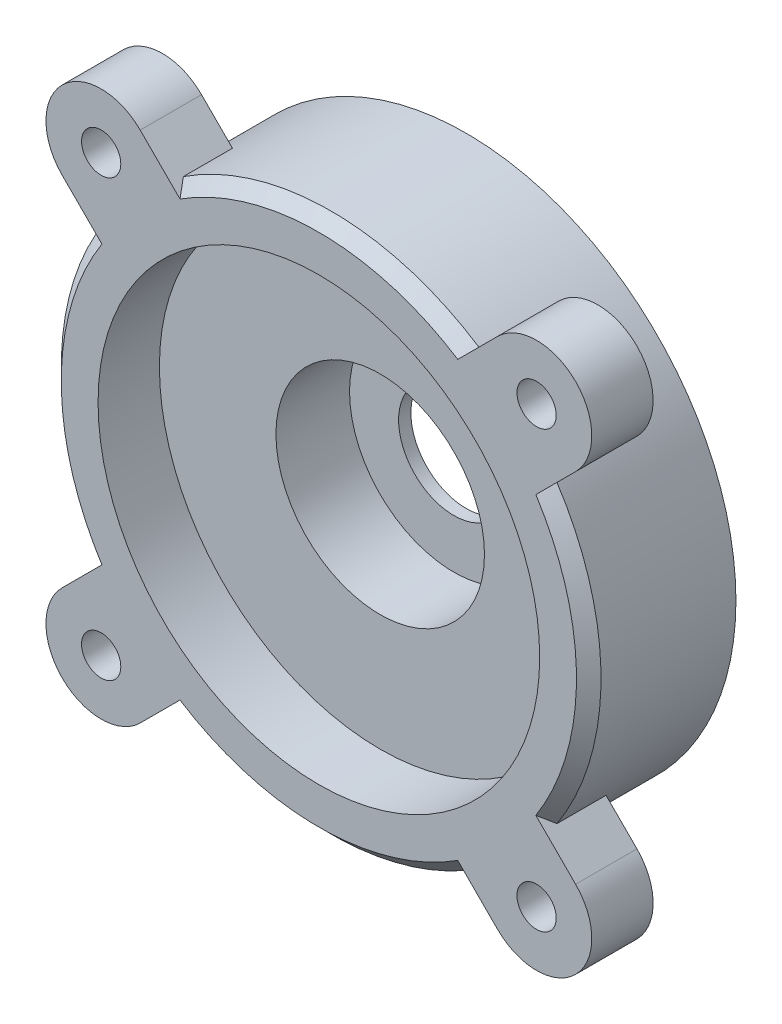
from build123d import *

# Parameters (mm, degrees)
SKETCH1_R           = 22
BOSS_EXTRUDE1_DEPTH = 6
CHAMFER1_SIZE       = 1
SKETCH8_R           = 1.6
BOSS_EXTRUDE2_DEPTH = 5
SKETCH9_R           = 18
CUT_EXTRUDE1_DEPTH  = 5
SKETCH10_R          = 8.5
CUT_EXTRUDE2_DEPTH  = 6
SKETCH11_R          = 4.5
CUT_EXTRUDE3_DEPTH  = 1


with BuildPart() as part:
    # Sketch1 → Boss-Extrude1 (new, symmetric)
    with BuildSketch(Plane.XY):
        Circle(SKETCH1_R)
    extrude(amount=BOSS_EXTRUDE1_DEPTH, both=True)

    # Chamfer1
    chamfer1_edges = [part.edges().sort_by_distance(p)[0] for p in [
        (-22, 0, 6),
    ]]
    chamfer(chamfer1_edges, length=CHAMFER1_SIZE)

    # Sketch8 → Boss-Extrude2 (add)
    # profile 1 of 4: a face of its own
    with BuildSketch(Plane.XY.offset(6)):
        with BuildLine():
            Line((20.930360723, -14.566399692), (17.68629022, -11.322329189))
            Line((17.68629022, -11.322329189), (11.322329189, -17.68629022))
            Line((11.322329189, -17.68629022), (14.566399692, -20.930360723))
            ThreePointArc((14.566399692, -20.930360723), (20.930360723, -20.930360723), (20.930360723, -14.566399692))
        make_face()
        with Locations((17.748380208, -17.748380208)):
            Circle(SKETCH8_R, mode=Mode.SUBTRACT)
    # profile 2 of 4: a face of its own
    with BuildSketch(Plane.XY.offset(6)):
        with BuildLine():
            Line((14.566399692, 20.930360723), (11.322329189, 17.68629022))
            Line((11.322329189, 17.68629022), (17.68629022, 11.322329189))
            Line((17.68629022, 11.322329189), (20.930360723, 14.566399692))
            ThreePointArc((20.930360723, 14.566399692), (20.930360723, 20.930360723), (14.566399692, 20.930360723))
        make_face()
        with Locations((17.748380208, 17.748380208)):
            Circle(SKETCH8_R, mode=Mode.SUBTRACT)
    # profile 3 of 4: a face of its own
    with BuildSketch(Plane.XY.offset(6)):
        with BuildLine():
            Line((-14.566399692, -20.930360723), (-11.322329189, -17.68629022))
            Line((-11.322329189, -17.68629022), (-17.68629022, -11.322329189))
            Line((-17.68629022, -11.322329189), (-20.930360723, -14.566399692))
            ThreePointArc((-20.930360723, -14.566399692), (-20.930360723, -20.930360723), (-14.566399692, -20.930360723))
        make_face()
        with Locations((-17.748380208, -17.748380208)):
            Circle(SKETCH8_R, mode=Mode.SUBTRACT)
    # profile 4 of 4: a face of its own
    with BuildSketch(Plane.XY.offset(6)):
        with BuildLine():
            Line((-20.930360723, 14.566399692), (-17.68629022, 11.322329189))
            Line((-17.68629022, 11.322329189), (-11.322329189, 17.68629022))
            Line((-11.322329189, 17.68629022), (-14.566399692, 20.930360723))
            ThreePointArc((-14.566399692, 20.930360723), (-20.930360723, 20.930360723), (-20.930360723, 14.566399692))
        make_face()
        with Locations((-17.748380208, 17.748380208)):
            Circle(SKETCH8_R, mode=Mode.SUBTRACT)
    extrude(amount=-BOSS_EXTRUDE2_DEPTH)

    # Sketch9 → Cut-Extrude1 (cut)
    with BuildSketch(Plane.XY.offset(6)):
        Circle(SKETCH9_R)
    extrude(amount=-CUT_EXTRUDE1_DEPTH, mode=Mode.SUBTRACT)

    # Sketch10 → Cut-Extrude2 (cut)
    with BuildSketch(Plane.XY.offset(1)):
        Circle(SKETCH10_R)
    extrude(amount=-CUT_EXTRUDE2_DEPTH, mode=Mode.SUBTRACT)

    # Sketch11 → Cut-Extrude3 (cut)
    with BuildSketch(Plane.XY.offset(-5)):
        Circle(SKETCH11_R)
    extrude(amount=-CUT_EXTRUDE3_DEPTH, mode=Mode.SUBTRACT)


solid = part.part
